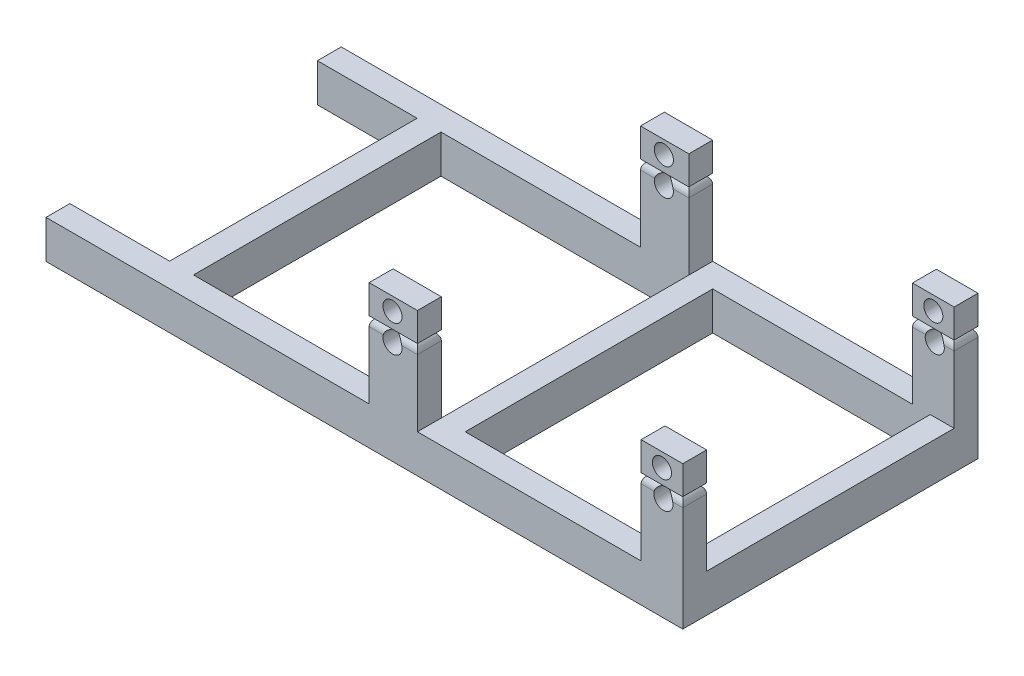
from build123d import *

# Parameters (mm, degrees)
SKETCH1_W               = 518.953439809
SKETCH1_H               = 518.249184403
SKETCH1_W_2             = 455.6
BOSS_EXTRUDE3_DEPTH     = 80
SKETCH2_W               = 101.131848524
SKETCH2_H               = 50
SKETCH2_W_2             = 87.153604081
BOSS_EXTRUDE4_DEPTH     = 160
FILLET1_R               = 20
CUT_EXTRUDE3_DEPTH      = 1373.160931607
CUT_EXTRUDE3_DEPTH_BACK = 10
SKETCH5_R               = 20
CUT_EXTRUDE4_DEPTH      = 1382.534741242
CUT_EXTRUDE4_DEPTH_BACK = 1382.534741242
SKETCH3_R               = 20
CUT_EXTRUDE5_DEPTH      = 1382.534741304
CUT_EXTRUDE5_DEPTH_BACK = 1382.534741304
SKETCH4_R               = 20
SKETCH6_W               = 101.131848524
SKETCH6_H               = 50
BOSS_EXTRUDE5_DEPTH     = 60
CUT_EXTRUDE6_DEPTH      = 1394.211484888
CUT_EXTRUDE6_DEPTH_BACK = 1394.211484888
SKETCH7_R               = 20
SKETCH8_W               = 87.153604081
SKETCH8_H               = 50
BOSS_EXTRUDE6_DEPTH     = 60
CUT_EXTRUDE7_DEPTH      = 1394.211484888
CUT_EXTRUDE7_DEPTH_BACK = 1394.211484888
SKETCH9_R               = 20


with BuildPart() as part:
    # Sketch1 → Boss-Extrude3 (new body)
    with BuildSketch(Plane(origin=(0, 0, 0), x_dir=(1, 0, 0), z_dir=(0, 1, 0))):
        Polygon((-121.456854781, 21.240444949), (1211.943145219, 21.240444949), (1211.943145219, -50.701004169), (1211.943145219, -568.950188572), (1211.943145219, -597.008739454), (-121.456854781, -597.008739454), (-121.456854781, -547.008739454), (87.38970541, -547.008739454), (87.38970541, -28.759555051), (-121.456854781, -28.759555051), align=None)
        with Locations((396.866425315, -287.884147253)):
            Rectangle(SKETCH1_W, SKETCH1_H, mode=Mode.SUBTRACT)
        with Locations((934.143145219, -287.884147253)):
            Rectangle(SKETCH1_W_2, SKETCH1_H, mode=Mode.SUBTRACT)
    extrude(amount=BOSS_EXTRUDE3_DEPTH)

    # Sketch2 → Boss-Extrude4 (add)
    with BuildSketch(Plane(origin=(0, 80, 0), x_dir=(1, 0, 0), z_dir=(0, 1, 0))):
        with Locations((605.777220957, -3.759555051)):
            Rectangle(SKETCH2_W, SKETCH2_H)
        with Locations((1168.366343179, -3.759555051)):
            Rectangle(SKETCH2_W_2, SKETCH2_H)
        with Locations((605.777220957, -572.008739454)):
            Rectangle(SKETCH2_W, SKETCH2_H)
        with Locations((1168.366343179, -572.008739454)):
            Rectangle(SKETCH2_W_2, SKETCH2_H)
    extrude(amount=BOSS_EXTRUDE4_DEPTH)

    # Fillet1
    fillet1_edges = [part.edges().sort_by_distance(p)[0] for p in [
        (656.343145219, 240, 572.008739454),
        (605.777220957, 240, 547.008739454),
        (555.211296695, 240, 572.008739454),
        (605.777220957, 240, 597.008739454),
        (1124.789541138, 240, 3.759555051),
        (1168.366343178, 240, 28.759555051),
        (1211.943145219, 240, 3.759555051),
        (1168.366343178, 240, -21.240444949),
        (1124.789541138, 240, 572.008739454),
        (1168.366343178, 240, 597.008739454),
        (1211.943145219, 240, 572.008739454),
        (1168.366343178, 240, 547.008739454),
        (555.211296695, 240, 3.759555051),
        (605.777220957, 240, 28.759555051),
        (656.343145219, 240, 3.759555051),
        (605.777220957, 240, -21.240444949),
    ]]
    fillet(fillet1_edges, radius=FILLET1_R)

    # Sketch5 → Cut-Extrude3 (cut, two sides: drawn at the far end of the back side and taken through both)
    with BuildSketch(Plane(origin=(0, 0, 0), x_dir=(-1, 0, 0), z_dir=(0, -1, 0)).offset(-CUT_EXTRUDE3_DEPTH_BACK)):
        with Locations(Location((-1187.046867592, -287.884147253, 0), (0, 0, 270))):
            Circle(SKETCH5_R)
    extrude(amount=CUT_EXTRUDE3_DEPTH + CUT_EXTRUDE3_DEPTH_BACK, mode=Mode.SUBTRACT)

    # Sketch3 → Cut-Extrude4 (cut, two sides: drawn at the far end of the back side and taken through both)
    with BuildSketch(Plane(origin=(0, 0, -21.240444949), x_dir=(-1, 0, 0), z_dir=(0, 0, -1)).offset(-CUT_EXTRUDE4_DEPTH_BACK)):
        with Locations(Location((-604.119324359, 215.055032995, 0), (0, 0, 14.314743265))):
            Circle(SKETCH3_R)
    extrude(amount=CUT_EXTRUDE4_DEPTH + CUT_EXTRUDE4_DEPTH_BACK, mode=Mode.SUBTRACT)

    # Sketch4 → Cut-Extrude5 (cut, two sides: drawn at the far end of the back side and taken through both)
    with BuildSketch(Plane(origin=(0, 0, -21.240444949), x_dir=(-1, 0, 0), z_dir=(0, 0, -1)).offset(-CUT_EXTRUDE5_DEPTH_BACK)):
        with Locations(Location((-1171.400402377, 215.184793276, 0), (0, 0, 13.931420355))):
            Circle(SKETCH4_R)
    extrude(amount=CUT_EXTRUDE5_DEPTH + CUT_EXTRUDE5_DEPTH_BACK, mode=Mode.SUBTRACT)

    # Sketch6 → Boss-Extrude5 (add)
    with BuildSketch(Plane(origin=(0, 240, 0), x_dir=(1, 0, 0), z_dir=(0, 1, 0))):
        with Locations((605.777220957, -3.759555051)):
            Rectangle(SKETCH6_W, SKETCH6_H)
        with Locations((605.777220957, -572.008739454)):
            Rectangle(SKETCH6_W, SKETCH6_H)
    extrude(amount=BOSS_EXTRUDE5_DEPTH)

    # Sketch7 → Cut-Extrude6 (cut, two sides: drawn at the far end of the back side and taken through both)
    with BuildSketch(Plane.XY.offset(597.008739454).offset(-CUT_EXTRUDE6_DEPTH_BACK)):
        with Locations((604.119324359, 272.419198887)):
            Circle(SKETCH7_R)
    extrude(amount=CUT_EXTRUDE6_DEPTH + CUT_EXTRUDE6_DEPTH_BACK, mode=Mode.SUBTRACT)

    # Sketch8 → Boss-Extrude6 (add)
    with BuildSketch(Plane(origin=(0, 240, 0), x_dir=(1, 0, 0), z_dir=(0, 1, 0))):
        with Locations((1168.366343179, -572.008739454)):
            Rectangle(SKETCH8_W, SKETCH8_H)
        with Locations((1168.366343179, -3.759555051)):
            Rectangle(SKETCH8_W, SKETCH8_H)
    extrude(amount=BOSS_EXTRUDE6_DEPTH)

    # Sketch9 → Cut-Extrude7 (cut, two sides: drawn at the far end of the back side and taken through both)
    with BuildSketch(Plane.XY.offset(597.008739454).offset(-CUT_EXTRUDE7_DEPTH_BACK)):
        with Locations((1168.366343178, 271.00396048)):
            Circle(SKETCH9_R)
    extrude(amount=CUT_EXTRUDE7_DEPTH + CUT_EXTRUDE7_DEPTH_BACK, mode=Mode.SUBTRACT)


solid = part.part
